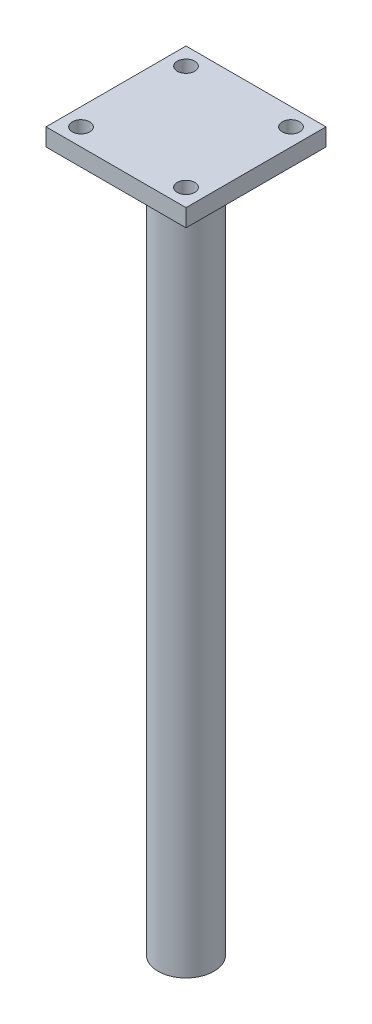
from build123d import *

# Parameters (mm, degrees)
SKETCH_1_R          = 8
EXTRUDE_1_DEPTH     = 200
SKETCH_2_W          = 40
SKETCH_2_H          = 40
EXTRUDE_2_DEPTH     = 5
SKETCH_3_R          = 2.5
CUT_EXTRUDE_1_DEPTH = 5


with BuildPart() as part:
    # 草图1 → 凸台-拉伸1 (new body)
    with BuildSketch(Plane(origin=(0, 0, 0), x_dir=(1, 0, 0), z_dir=(0, 1, 0))):
        with Locations(Location((0, 0, 0), (0, 0, 270))):
            Circle(SKETCH_1_R)
    extrude(amount=EXTRUDE_1_DEPTH)

    # 草图2 → 凸台-拉伸2 (add)
    with BuildSketch(Plane(origin=(0, 200, 0), x_dir=(1, 0, 0), z_dir=(0, 1, 0))):
        Rectangle(SKETCH_2_W, SKETCH_2_H)
    extrude(amount=EXTRUDE_2_DEPTH)

    # 草图3 → 切除-拉伸1 (cut)
    with BuildSketch(Plane(origin=(0, 205, 0), x_dir=(1, 0, 0), z_dir=(0, 1, 0))):
        with Locations(Location((-15, 15, 0), (0, 0, 270))):
            Circle(SKETCH_3_R)
        with Locations(Location((15, 15, 0), (0, 0, 270))):
            Circle(SKETCH_3_R)
        with Locations(Location((15, -15, 0), (0, 0, 270))):
            Circle(SKETCH_3_R)
        with Locations(Location((-15, -15, 0), (0, 0, 270))):
            Circle(SKETCH_3_R)
    extrude(amount=-CUT_EXTRUDE_1_DEPTH, mode=Mode.SUBTRACT)


solid = part.part
